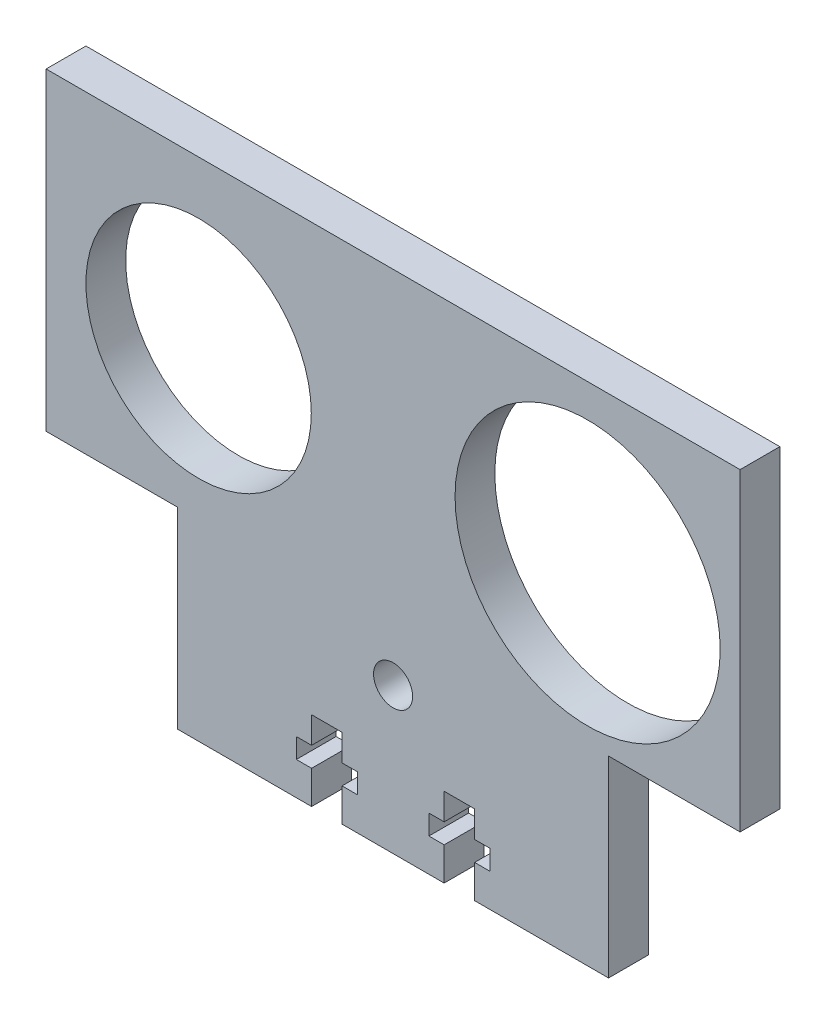
from build123d import *

# Parameters (mm, degrees)
SKETCH1_R           = 2.95
SKETCH1_R_2         = 17
SKETCH1_R_3         = 20
BOSS_EXTRUDE1_DEPTH = 6
CUT_EXTRUDE2_DEPTH  = 76.692558526


with BuildPart() as part:
    # Sketch1 → Boss-Extrude1 (new body)
    with BuildSketch(Plane.XY):
        Polygon((-32.5, 7), (-32.5, -22), (32.5, -22), (32.5, 7), (52.344931419, 7), (52.344931419, 54.344931419), (-52.344931419, 54.344931419), (-52.344931419, 7), align=None)
        Circle(SKETCH1_R, mode=Mode.SUBTRACT)
        with Locations((-29.344931419, 29.344931419)):
            Circle(SKETCH1_R_2, mode=Mode.SUBTRACT)
        with Locations((29.344931419, 29.344931419)):
            Circle(SKETCH1_R_3, mode=Mode.SUBTRACT)
    extrude(amount=BOSS_EXTRUDE1_DEPTH)

    # Sketch3 → Cut-Extrude2 (cut, through all)
    with BuildSketch(Plane.XY.offset(6)):
        Polygon((-12.3, -22), (-7.7, -22), (-7.7, -17), (-5.4, -17), (-5.4, -14), (-7.7, -14), (-7.7, -10), (-12.3, -10), (-12.3, -14), (-14.6, -14), (-14.6, -17), (-12.3, -17), align=None)
        Polygon((7.7, -14), (7.7, -10), (12.3, -10), (12.3, -14), (14.6, -14), (14.6, -17), (12.3, -17), (12.3, -22), (7.7, -22), (7.7, -17), (5.4, -17), (5.4, -14), align=None)
    extrude(amount=-CUT_EXTRUDE2_DEPTH, mode=Mode.SUBTRACT)


solid = part.part
